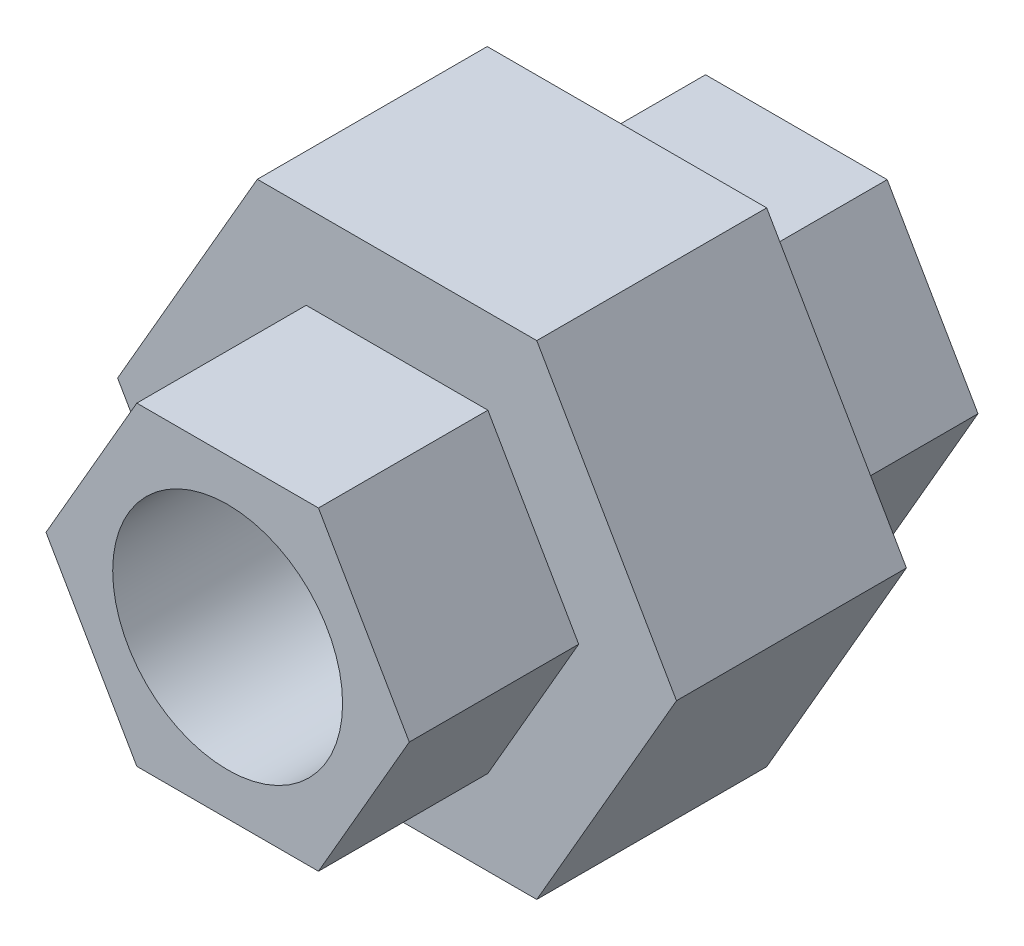
from build123d import *

# Parameters (mm, degrees)
BASIS_LINEAR_AUSTRAGEN_DEPTH    = 19
AUFSATZ_LINEAR_AUSTRAGEN1_DEPTH = 14
AUFSATZ_LINEAR_AUSTRAGEN2_DEPTH = 14
SKIZZE4_R                       = 9.5
SCHNITT_LINEAR_AUSTRAGEN1_DEPTH = 57.056519098


with BuildPart() as part:
    # Skizze1 → Basis-Linear austragen (new body)
    with BuildSketch(Plane.XY):
        Polygon((11.547005384, -20), (23.094010768, 0), (11.547005384, 20), (-11.547005384, 20), (-23.094010768, 0), (-11.547005384, -20), align=None)
    extrude(amount=BASIS_LINEAR_AUSTRAGEN_DEPTH)

    # Skizze2 → Aufsatz-Linear austragen1 (add)
    with BuildSketch(Plane.XY.offset(19)):
        Polygon((7.505553499, -13), (15.011106999, 0), (7.505553499, 13), (-7.505553499, 13), (-15.011106999, 0), (-7.505553499, -13), align=None)
    extrude(amount=AUFSATZ_LINEAR_AUSTRAGEN1_DEPTH)

    # Skizze3 → Aufsatz-Linear austragen2 (add)
    with BuildSketch(Plane(origin=(0, 0, 0), x_dir=(-1, 0, 0), z_dir=(0, 0, -1))):
        Polygon((7.505553499, -13), (15.011106999, 0), (7.505553499, 13), (-7.505553499, 13), (-15.011106999, 0), (-7.505553499, -13), align=None)
    extrude(amount=AUFSATZ_LINEAR_AUSTRAGEN2_DEPTH)

    # Skizze4 → Schnitt-Linear austragen1 (cut, through all)
    with BuildSketch(Plane.XY.offset(33)):
        Circle(SKIZZE4_R)
    extrude(amount=-SCHNITT_LINEAR_AUSTRAGEN1_DEPTH, mode=Mode.SUBTRACT)


solid = part.part
